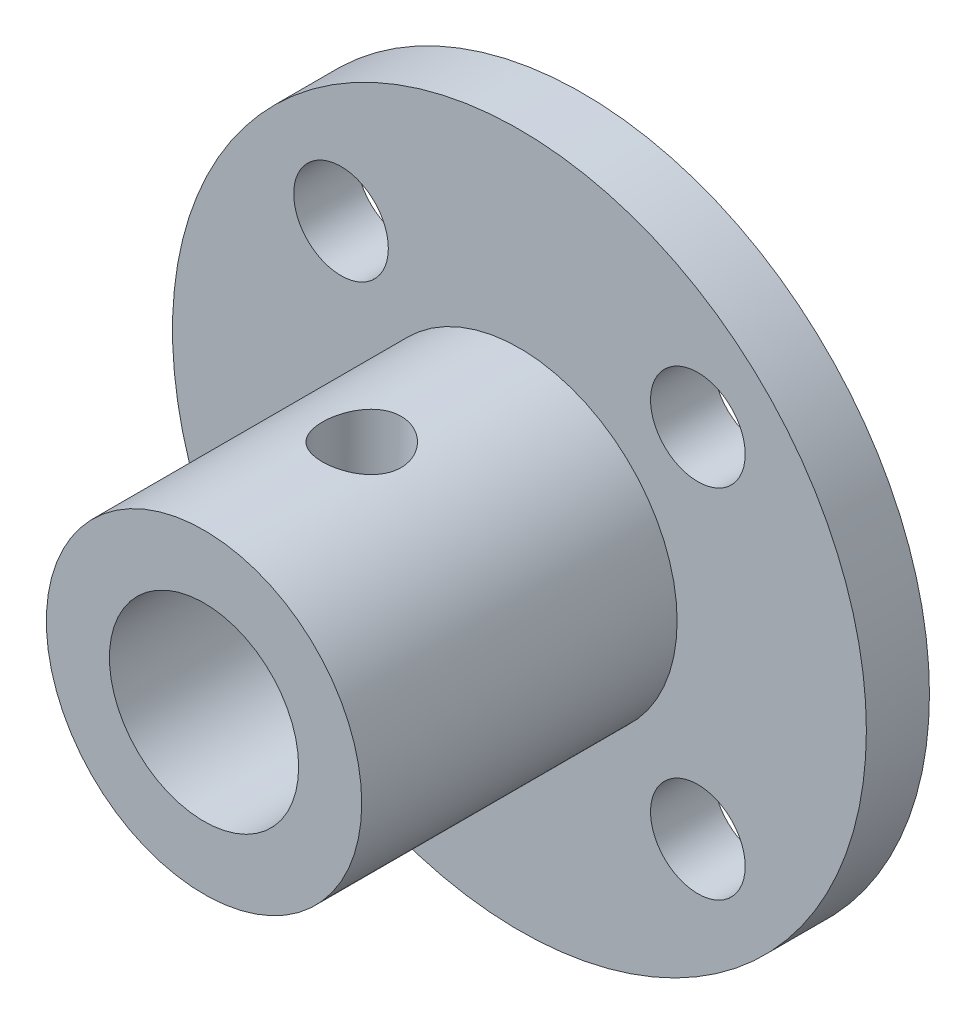
from build123d import *

# Parameters (mm, degrees)
SKETCH1_R             = 11
BOSS_EXTRUDE1_DEPTH   = 2
SKETCH2_R             = 5
BOSS_EXTRUDE2_DEPTH   = 10
CUT_EXTRUDE1_REACH    = 21.647
SKETCH3_R             = 3
SKETCH5_W             = 1.25
SKETCH5_H             = 5
F_3_0MM_DOWEL_HOLE1_D = 3


with BuildPart() as part:
    # Sketch1 → Boss-Extrude1 (new body)
    with BuildSketch(Plane.XY):
        Circle(SKETCH1_R)
    extrude(amount=BOSS_EXTRUDE1_DEPTH)

    # Sketch2 → Boss-Extrude2 (add)
    with BuildSketch(Plane.XY.offset(2)):
        Circle(SKETCH2_R)
    extrude(amount=BOSS_EXTRUDE2_DEPTH)

    # Sketch3 → Cut-Extrude1 (cut, up to next)
    with BuildSketch(Plane.XY.offset(12), mode=Mode.PRIVATE) as cut_extrude1_sk1:
        Circle(SKETCH3_R)
    cut_extrude1_tool1 = extrude(cut_extrude1_sk1.sketch, amount=-CUT_EXTRUDE1_REACH, mode=Mode.PRIVATE) & part.part
    add(cut_extrude1_tool1.solids().sort_by_distance((0, 0, 12))[0], mode=Mode.SUBTRACT)

    # Sketch5 → Tap Drill for M3x0.5 Tap1 (revolve, cut)
    with BuildSketch(Plane(origin=(0, 0, 7), x_dir=(0, 0, -1), z_dir=(1, 0, 0))):
        with Locations((0.625, 2.5)):
            Rectangle(SKETCH5_W, SKETCH5_H)
    revolve(axis=Axis((0, -6.35, 7), (0, 1, 0)), mode=Mode.SUBTRACT)

    # Ø3.0mm Dowel Hole1 (through all)
    with Locations(Plane.XY.offset(2)):
        with Locations((5.656854249, 5.656854249), (-5.656854249, -5.656854249), (-5.656854249, 5.656854249), (5.656854249, -5.656854249)):
            Hole(F_3_0MM_DOWEL_HOLE1_D / 2)


solid = part.part
